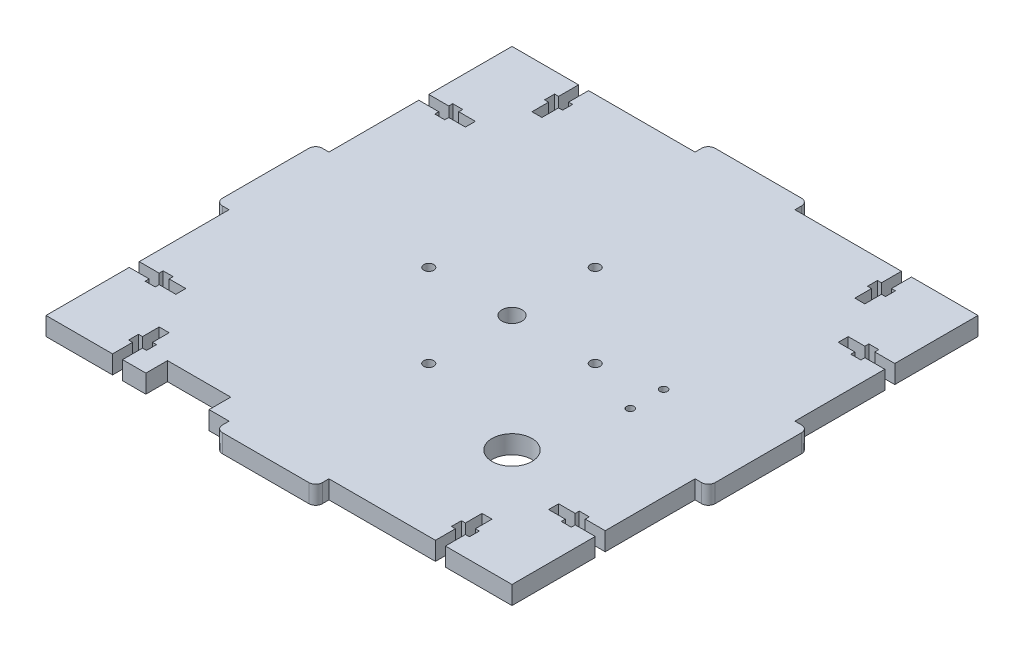
from build123d import *

# Parameters (mm, degrees)
SKETCH1_R           = 3
SKETCH1_R_2         = 1.5
SKETCH1_R_3         = 6
SKETCH1_R_4         = 1.125
BOSS_EXTRUDE1_DEPTH = 5.5
FILLET1_R           = 2


with BuildPart() as part:
    # Sketch1 → Boss-Extrude1 (new body)
    with BuildSketch(Plane(origin=(0, 0, 0), x_dir=(1, 0, 0), z_dir=(0, 1, 0))):
        Polygon((85, 0), (117, 0), (117, 6), (115.8, 6), (115.8, 9), (117, 9), (117, 14), (120, 14), (120, 9), (121.2, 9), (121.2, 6), (120, 6), (120, 0), (140, 0), (140, 25), (134, 25), (134, 23.8), (131, 23.8), (131, 25), (126, 25), (126, 28), (131, 28), (131, 29.2), (134, 29.2), (134, 28), (140, 28), (140, 55), (144, 55), (144, 85), (140, 85), (140, 112), (134, 112), (134, 110.8), (131, 110.8), (131, 112), (126, 112), (126, 115), (131, 115), (131, 116.2), (134, 116.2), (134, 115), (140, 115), (140, 140), (120, 140), (120, 134), (121.2, 134), (121.2, 131), (120, 131), (120, 126), (117, 126), (117, 131), (115.8, 131), (115.8, 134), (117, 134), (117, 140), (85, 140), (85, 144), (55, 144), (55, 140), (23, 140), (23, 134), (24.2, 134), (24.2, 131), (23, 131), (23, 126), (20, 126), (20, 131), (18.8, 131), (18.8, 134), (20, 134), (20, 140), (0, 140), (0, 115), (6, 115), (6, 116.2), (9, 116.2), (9, 115), (14, 115), (14, 112), (9, 112), (9, 110.8), (6, 110.8), (6, 112), (0, 112), (0, 85), (-4, 85), (-4, 55), (0, 55), (0, 28), (6, 28), (6, 29.2), (9, 29.2), (9, 28), (14, 28), (14, 25), (9, 25), (9, 23.8), (6, 23.8), (6, 25), (0, 25), (0, 0), (20, 0), (20, 6), (18.8, 6), (18.8, 9), (20, 9), (20, 14), (23, 14), (23, 9), (24.2, 9), (24.2, 6), (23, 6), (23, 0), (30, 0), (30, 6.5), (49, 6.5), (49, 0), (55, 0), (55, -4), (85, -4), align=None)
        with Locations(Location((70, 70, 0), (0, 0, 270))):
            Circle(SKETCH1_R, mode=Mode.SUBTRACT)
        with Locations(Location((70, 95, 0), (0, 0, 270))):
            Circle(SKETCH1_R_2, mode=Mode.SUBTRACT)
        with Locations(Location((95, 70, 0), (0, 0, 270))):
            Circle(SKETCH1_R_2, mode=Mode.SUBTRACT)
        with Locations(Location((70, 45, 0), (0, 0, 270))):
            Circle(SKETCH1_R_2, mode=Mode.SUBTRACT)
        with Locations(Location((45, 70, 0), (0, 0, 270))):
            Circle(SKETCH1_R_2, mode=Mode.SUBTRACT)
        with Locations(Location((105, 35, 0), (0, 0, 270))):
            Circle(SKETCH1_R_3, mode=Mode.SUBTRACT)
        with Locations(Location((112, 73.556484563, 0), (0, 0, 270))):
            Circle(SKETCH1_R_4, mode=Mode.SUBTRACT)
        with Locations(Location((112, 63.556484563, 0), (0, 0, 270))):
            Circle(SKETCH1_R_4, mode=Mode.SUBTRACT)
    extrude(amount=BOSS_EXTRUDE1_DEPTH)

    # Fillet1
    fillet1_edges = [part.edges().sort_by_distance(p)[0] for p in [
        (-4, 2.75, -55),
        (-4, 2.75, -85),
        (55, 2.75, -144),
        (85, 2.75, -144),
        (144, 2.75, -85),
        (144, 2.75, -55),
        (85, 2.75, 4),
        (55, 2.75, 4),
    ]]
    fillet(fillet1_edges, radius=FILLET1_R)


solid = part.part
